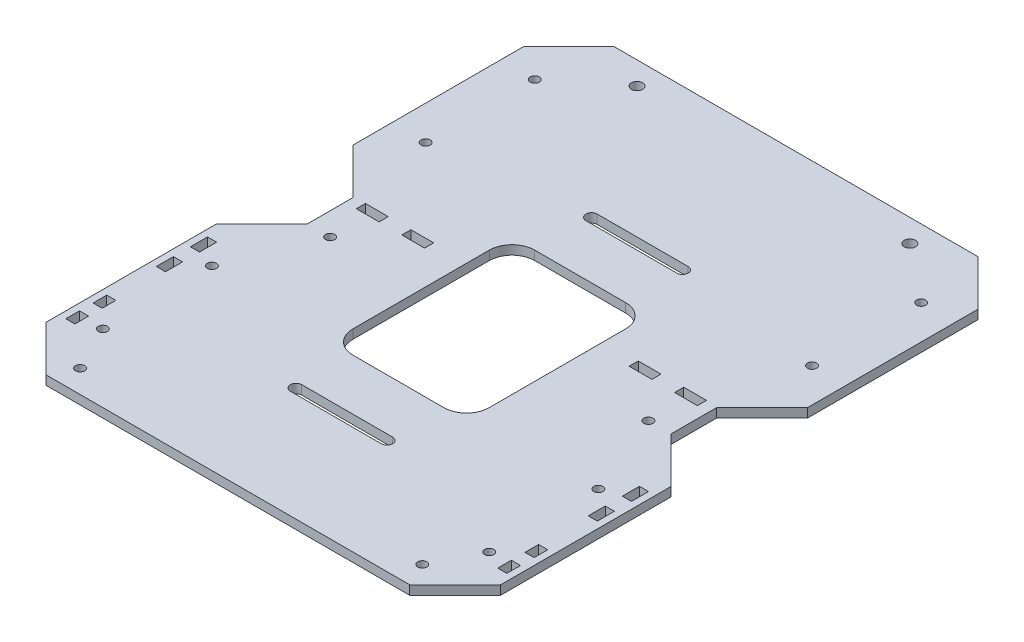
from build123d import *

# Parameters (mm, degrees)
SKETCH1_R           = 2
SKETCH1_R_2         = 2.5
SKETCH1_W           = 4
SKETCH1_H           = 7.5
SKETCH1_H_2         = 6
SKETCH1_W_2         = 10
SKETCH1_H_3         = 4
BOSS_EXTRUDE1_DEPTH = 4


with BuildPart() as part:
    # Sketch1 → Boss-Extrude1 (new body)
    with BuildSketch(Plane(origin=(0, 0, 0), x_dir=(1, 0, 0), z_dir=(0, 1, 0))):
        Polygon((80, 124.45742592), (-80, 124.45742592), (-100, 104.45742592), (-100, 29.45742592), (-80, 9.45742592), (-80, -10.54257408), (-100, -30.54257408), (-100, -105.54257408), (-80, -125.54257408), (80, -125.54257408), (100, -105.54257408), (100, -30.54257408), (80, -10.54257408), (80, 9.45742592), (100, 29.45742592), (100, 104.45742592), align=None)
        with Locations(Location((-85, 94.45742592, 0), (0, 0, 270))):
            Circle(SKETCH1_R, mode=Mode.SUBTRACT)
        with Locations(Location((-85, 46.45742592, 0), (0, 0, 270))):
            Circle(SKETCH1_R, mode=Mode.SUBTRACT)
        with Locations(Location((85, 94.45742592, 0), (0, 0, 90))):
            Circle(SKETCH1_R, mode=Mode.SUBTRACT)
        with Locations(Location((85, 46.45742592, 0), (0, 0, 90))):
            Circle(SKETCH1_R, mode=Mode.SUBTRACT)
        with Locations(Location((85, -47.54257408, 0), (0, 0, 270))):
            Circle(SKETCH1_R, mode=Mode.SUBTRACT)
        with Locations(Location((85, -95.54257408, 0), (0, 0, 270))):
            Circle(SKETCH1_R, mode=Mode.SUBTRACT)
        with Locations(Location((-85, -47.54257408, 0), (0, 0, 90))):
            Circle(SKETCH1_R, mode=Mode.SUBTRACT)
        with Locations(Location((-85, -95.54257408, 0), (0, 0, 90))):
            Circle(SKETCH1_R, mode=Mode.SUBTRACT)
        with Locations(Location((60, 114.45742592, 0), (0, 0, 270))):
            Circle(SKETCH1_R_2, mode=Mode.SUBTRACT)
        with Locations(Location((-60, 114.45742592, 0), (0, 0, 90))):
            Circle(SKETCH1_R_2, mode=Mode.SUBTRACT)
        with Locations(Location((-75, -115.54257408, 0), (0, 0, 270))):
            Circle(SKETCH1_R, mode=Mode.SUBTRACT)
        with Locations(Location((-70, -10.54257408, 0), (0, 0, 270))):
            Circle(SKETCH1_R, mode=Mode.SUBTRACT)
        with Locations(Location((75, -115, 0), (0, 0, 270))):
            Circle(SKETCH1_R, mode=Mode.SUBTRACT)
        with Locations(Location((70, -10.54257408, 0), (0, 0, 270))):
            Circle(SKETCH1_R, mode=Mode.SUBTRACT)
        with BuildLine():
            Line((-20, 29.45742592), (20, 29.45742592))
            ThreePointArc((20, 29.45742592), (27.071067812, 26.528493731), (30, 19.45742592))
            Line((30, 19.45742592), (30, -40.54257408))
            ThreePointArc((30, -40.54257408), (27.071067812, -47.613641892), (20, -50.54257408))
            Line((20, -50.54257408), (-20, -50.54257408))
            ThreePointArc((-20, -50.54257408), (-27.071067812, -47.613641892), (-30, -40.54257408))
            Line((-30, -40.54257408), (-30, 19.45742592))
            ThreePointArc((-30, 19.45742592), (-27.071067812, 26.528493731), (-20, 29.45742592))
        make_face(mode=Mode.SUBTRACT)
        with BuildLine():
            Line((20, -73.04257408), (-20, -73.04257408))
            ThreePointArc((-20, -73.04257408), (-22.5, -75.54257408), (-20, -78.04257408))
            Line((-20, -78.04257408), (20, -78.04257408))
            ThreePointArc((20, -78.04257408), (22.5, -75.54257408), (20, -73.04257408))
        make_face(mode=Mode.SUBTRACT)
        with Locations((95, -41.25)):
            Rectangle(SKETCH1_W, SKETCH1_H, mode=Mode.SUBTRACT)
        with Locations((95, -96.822248533)):
            Rectangle(SKETCH1_W, SKETCH1_H_2, mode=Mode.SUBTRACT)
        with Locations((70, 8)):
            Rectangle(SKETCH1_W_2, SKETCH1_H_3, mode=Mode.SUBTRACT)
        with Locations((95, -56.25)):
            Rectangle(SKETCH1_W, SKETCH1_H, mode=Mode.SUBTRACT)
        with Locations((50, 8)):
            Rectangle(SKETCH1_W_2, SKETCH1_H_3, mode=Mode.SUBTRACT)
        with Locations((95, -84.822248533)):
            Rectangle(SKETCH1_W, SKETCH1_H_2, mode=Mode.SUBTRACT)
        with Locations((-95, -96.822248533)):
            Rectangle(SKETCH1_W, SKETCH1_H_2, mode=Mode.SUBTRACT)
        with Locations((-95, -84.822248533)):
            Rectangle(SKETCH1_W, SKETCH1_H_2, mode=Mode.SUBTRACT)
        with Locations((-95, -56.25)):
            Rectangle(SKETCH1_W, SKETCH1_H, mode=Mode.SUBTRACT)
        with Locations((-95, -41.25)):
            Rectangle(SKETCH1_W, SKETCH1_H, mode=Mode.SUBTRACT)
        with Locations((-50, 8)):
            Rectangle(SKETCH1_W_2, SKETCH1_H_3, mode=Mode.SUBTRACT)
        with Locations((-70, 8)):
            Rectangle(SKETCH1_W_2, SKETCH1_H_3, mode=Mode.SUBTRACT)
        with BuildLine():
            Line((20, 51.95742592), (-20, 51.95742592))
            ThreePointArc((-20, 51.95742592), (-22.5, 54.45742592), (-20, 56.95742592))
            Line((-20, 56.95742592), (20, 56.95742592))
            ThreePointArc((20, 56.95742592), (22.5, 54.45742592), (20, 51.95742592))
        make_face(mode=Mode.SUBTRACT)
    extrude(amount=BOSS_EXTRUDE1_DEPTH)


solid = part.part
